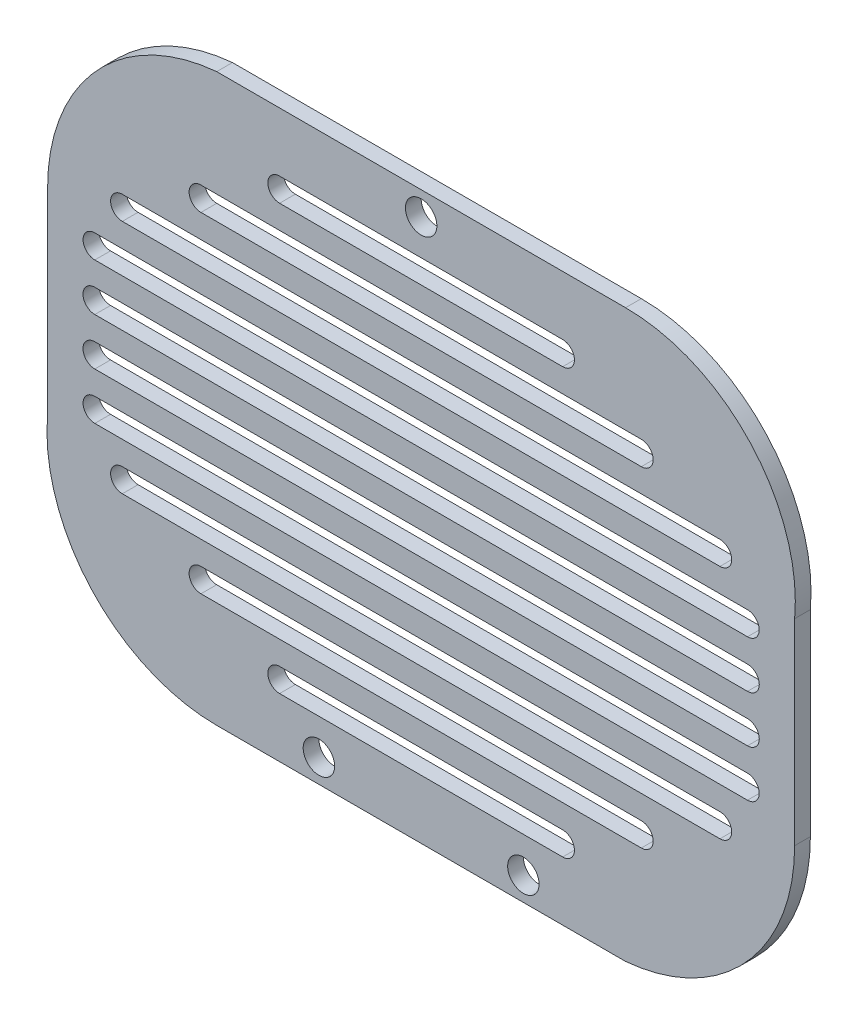
from build123d import *

# Parameters (mm, degrees)
SKETCH1_W           = 52
SKETCH1_H           = 23.5
SKETCH1_W_2         = 21.5
SKETCH1_H_2         = 25
BOSS_EXTRUDE1_DEPTH = 2
CUT_EXTRUDE1_DEPTH  = 2
SKETCH3_R           = 2
CUT_EXTRUDE2_DEPTH  = 10


with BuildPart() as part:
    # Sketch1 → Boss-Extrude1 (new body)
    with BuildSketch(Plane.XY):
        with Locations((0, 24.25)):
            Rectangle(SKETCH1_W, SKETCH1_H)
        with BuildLine():
            Line((26, 36), (26, 12.5))
            Line((26, 12.5), (47.5, 12.5))
            ThreePointArc((47.5, 12.5), (41.925608309, 28.985131006), (26, 36))
        make_face()
        with Locations((36.75, 0)):
            Rectangle(SKETCH1_W_2, SKETCH1_H_2)
        Rectangle(SKETCH1_W, SKETCH1_H_2)
        with BuildLine():
            Line((47.5, -12.5), (26, -12.5))
            Line((26, -12.5), (26, -36))
            ThreePointArc((26, -36), (41.314036989, -28.425608309), (47.5, -12.5))
        make_face()
        with Locations((0, -24.25)):
            Rectangle(SKETCH1_W, SKETCH1_H)
        with BuildLine():
            Line((-26, -12.5), (-47.5, -12.5))
            ThreePointArc((-47.5, -12.5), (-41.925608309, -28.985131006), (-26, -36))
            Line((-26, -36), (-26, -12.5))
        make_face()
        with Locations((-36.75, 0)):
            Rectangle(SKETCH1_W_2, SKETCH1_H_2)
        with BuildLine():
            ThreePointArc((-26, 36), (-41.314036989, 28.425608309), (-47.5, 12.5))
            Line((-47.5, 12.5), (-26, 12.5))
            Line((-26, 12.5), (-26, 36))
        make_face()
    extrude(amount=BOSS_EXTRUDE1_DEPTH)

    # Sketch2 → Cut-Extrude1 (cut)
    with BuildSketch(Plane.XY.offset(2)):
        with BuildLine():
            Line((0, -1.499605822), (-41.5, -1.499605822))
            ThreePointArc((-41.5, -1.499605822), (-43.000394178, -3), (-41.5, -4.500394178))
            Line((-41.5, -4.500394178), (41.5, -4.500394178))
            ThreePointArc((41.5, -4.500394178), (43.000394178, -3), (41.5, -1.499605822))
            Line((41.5, -1.499605822), (0, -1.499605822))
        make_face()
        with BuildLine():
            ThreePointArc((-18, 28.495571567), (-19.495571567, 27), (-18, 25.504428433))
            Line((-18, 25.504428433), (18, 25.504428433))
            ThreePointArc((18, 25.504428433), (19.495571567, 27), (18, 28.495571567))
            Line((18, 28.495571567), (-18, 28.495571567))
        make_face()
        with BuildLine():
            Line((41.5, -7.509541658), (-41.5, -7.509541658))
            ThreePointArc((-41.5, -7.509541658), (-42.990458342, -9), (-41.5, -10.490458342))
            Line((-41.5, -10.490458342), (41.5, -10.490458342))
            ThreePointArc((41.5, -10.490458342), (42.990458342, -9), (41.5, -7.509541658))
        make_face()
        with BuildLine():
            Line((38, -13.507793121), (-38, -13.507793121))
            ThreePointArc((-38, -13.507793121), (-39.492206879, -15), (-38, -16.492206879))
            Line((-38, -16.492206879), (38, -16.492206879))
            ThreePointArc((38, -16.492206879), (39.492206879, -15), (38, -13.507793121))
        make_face()
        with BuildLine():
            Line((28, -19.493656832), (-28, -19.493656832))
            ThreePointArc((-28, -19.493656832), (-29.506343168, -21), (-28, -22.506343168))
            Line((-28, -22.506343168), (0, -22.506343168))
            Line((0, -22.506343168), (28, -22.506343168))
            ThreePointArc((28, -22.506343168), (29.506343168, -21), (28, -19.493656832))
        make_face()
        with BuildLine():
            Line((18, -25.504428433), (-18, -25.504428433))
            ThreePointArc((-18, -25.504428433), (-19.495571567, -27), (-18, -28.495571567))
            Line((-18, -28.495571567), (18, -28.495571567))
            ThreePointArc((18, -28.495571567), (19.495571567, -27), (18, -25.504428433))
        make_face()
        with BuildLine():
            ThreePointArc((-28, 22.506343168), (-29.506343168, 21), (-28, 19.493656832))
            Line((-28, 19.493656832), (28, 19.493656832))
            ThreePointArc((28, 19.493656832), (29.506343168, 21), (28, 22.506343168))
            Line((28, 22.506343168), (0, 22.506343168))
            Line((0, 22.506343168), (-28, 22.506343168))
        make_face()
        with BuildLine():
            ThreePointArc((-38, 16.492206879), (-39.492206879, 15), (-38, 13.507793121))
            Line((-38, 13.507793121), (38, 13.507793121))
            ThreePointArc((38, 13.507793121), (39.492206879, 15), (38, 16.492206879))
            Line((38, 16.492206879), (-38, 16.492206879))
        make_face()
        with BuildLine():
            ThreePointArc((-41.5, 10.490458342), (-42.990458342, 9), (-41.5, 7.509541658))
            Line((-41.5, 7.509541658), (41.5, 7.509541658))
            ThreePointArc((41.5, 7.509541658), (42.990458342, 9), (41.5, 10.490458342))
            Line((41.5, 10.490458342), (-41.5, 10.490458342))
        make_face()
        with BuildLine():
            ThreePointArc((-41.5, 4.500394178), (-43.000394178, 3), (-41.5, 1.499605822))
            Line((-41.5, 1.499605822), (41.5, 1.499605822))
            ThreePointArc((41.5, 1.499605822), (43.000394178, 3), (41.5, 4.500394178))
            Line((41.5, 4.500394178), (-41.5, 4.500394178))
        make_face()
    extrude(amount=-CUT_EXTRUDE1_DEPTH, mode=Mode.SUBTRACT)

    # Sketch3 → Cut-Extrude2 (cut)
    with BuildSketch(Plane.XY.offset(2)):
        with Locations((0, 33)):
            Circle(SKETCH3_R)
        with Locations((-13, -33)):
            Circle(SKETCH3_R)
        with Locations((13, -33)):
            Circle(SKETCH3_R)
    extrude(amount=-CUT_EXTRUDE2_DEPTH, mode=Mode.SUBTRACT)


solid = part.part
